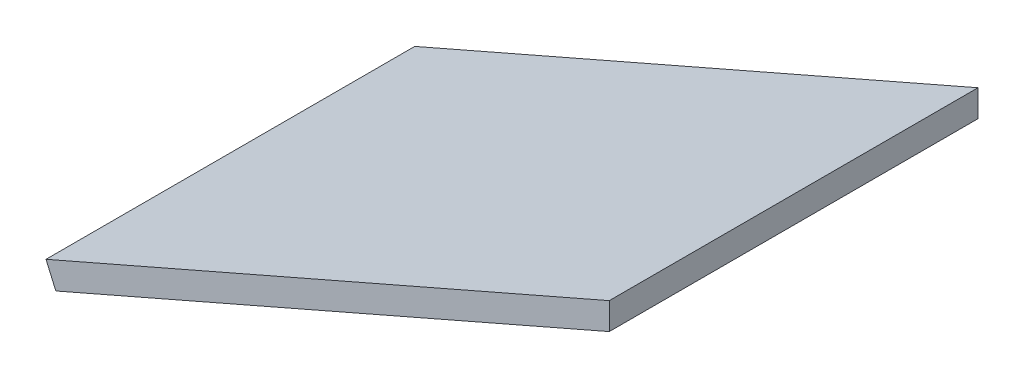
from build123d import *

# Parameters (mm, degrees)
RESSALTO_EXTRUS_O1_DEPTH = 30


with BuildPart() as part:
    # Esboço1 → Ressalto-extrusão1 (new body)
    with BuildSketch(Plane.XY):
        Polygon((22.112878475, 9.650851376), (-22.912878475, -10), (-23.712878475, -8.166969722), (22.112878475, 11.833030278), align=None)
    extrude(amount=RESSALTO_EXTRUS_O1_DEPTH)


solid = part.part
